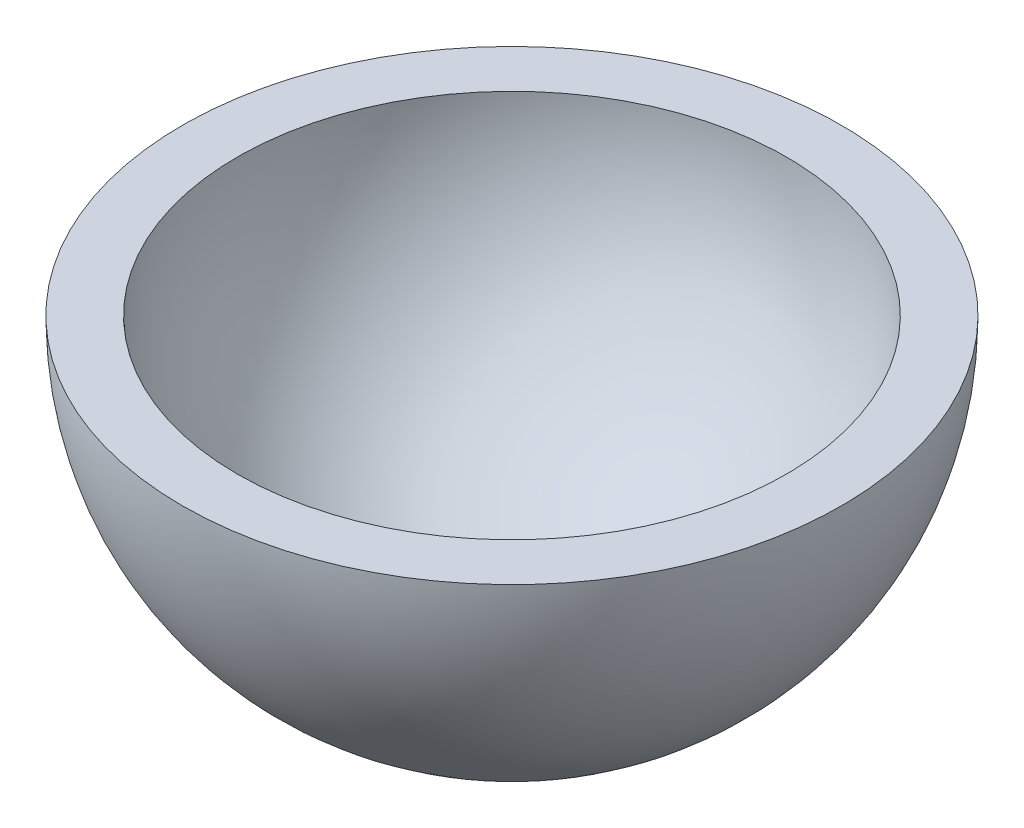
from build123d import *

# Parameters (mm, degrees)
REVOLVE1_ANGLE = 180


with BuildPart() as part:
    # Sketch1 → Revolve1 (revolve)
    with BuildSketch(Plane(origin=(0, 0, 0), x_dir=(1, 0, 0), z_dir=(0, 1, 0))):
        with BuildLine():
            Line((0, 6), (0, 5))
            ThreePointArc((0, 5), (-5, 0), (0, -5))
            Line((0, -5), (0, -6))
            ThreePointArc((0, -6), (-6, 0), (0, 6))
        make_face()
    revolve(axis=Axis((0, 0, -6), (0, 0, 1)), revolution_arc=REVOLVE1_ANGLE)


solid = part.part
